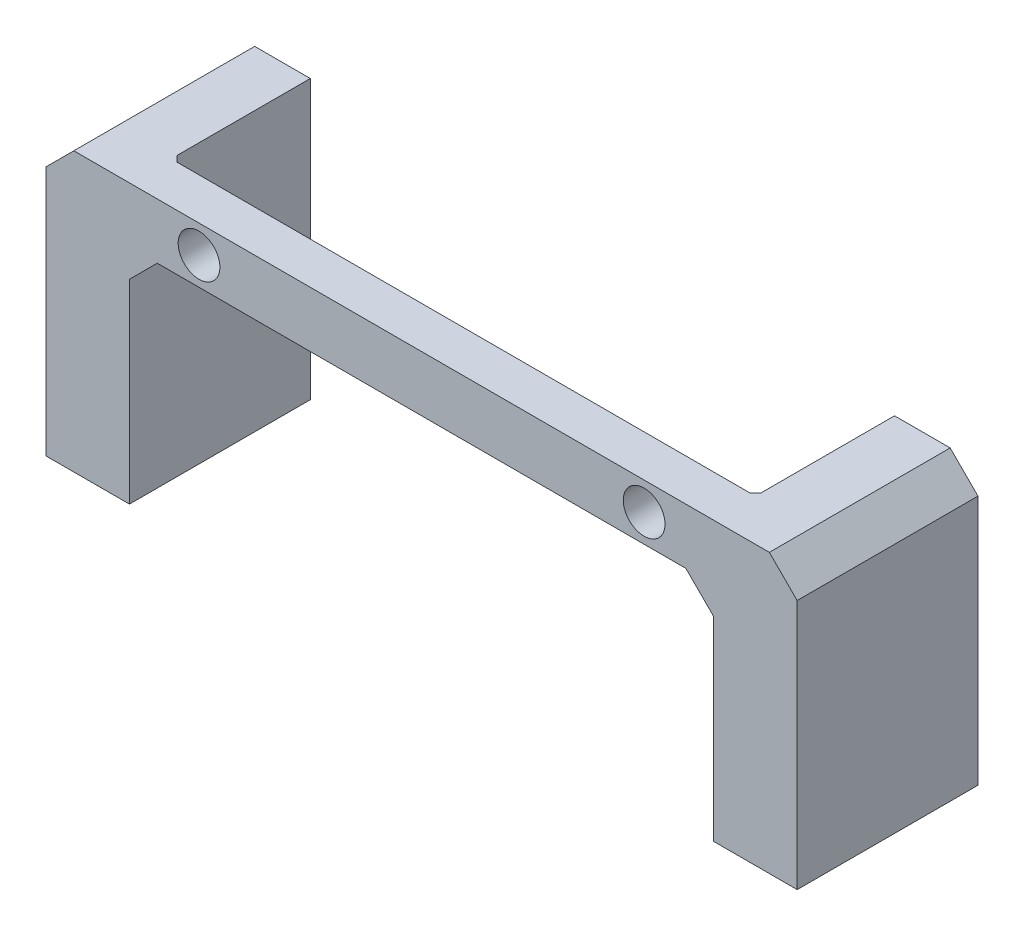
from build123d import *

# Parameters (mm, degrees)
SKETCH_1_W          = 54
SKETCH_1_H          = 20
EXTRUDE_1_DEPTH     = 13
SKETCH_2_W          = 42
SKETCH_2_H          = 16
CUT_EXTRUDE_1_DEPTH = 32.591137998
SKETCH_3_R          = 1.5
CUT_EXTRUDE_2_DEPTH = 32.591137998
SKETCH_4_R          = 1.5
CUT_EXTRUDE_3_DEPTH = 13
SKETCH_5_W          = 42
SKETCH_5_H          = 10
CUT_EXTRUDE_4_DEPTH = 37.027767069
CHAMFER_1_SIZE      = 2
CHAMFER_2_SIZE      = 2
CHAMFER_3_SIZE      = 0.4


with BuildPart() as part:
    # 草圖1 → 填料-伸長1 (new body)
    with BuildSketch(Plane.XY):
        Rectangle(SKETCH_1_W, SKETCH_1_H)
    extrude(amount=EXTRUDE_1_DEPTH)

    # 草圖2 → 除料-伸長1 (cut, through all)
    with BuildSketch(Plane.XY.offset(13)):
        with Locations((0, -2)):
            Rectangle(SKETCH_2_W, SKETCH_2_H)
    extrude(amount=-CUT_EXTRUDE_1_DEPTH, mode=Mode.SUBTRACT)

    # 草圖3 → 除料-伸長2 (cut, through all)
    with BuildSketch(Plane.XY.offset(13)):
        with Locations((-16, 8)):
            Circle(SKETCH_3_R)
        with Locations((16, 8)):
            Circle(SKETCH_3_R)
    extrude(amount=-CUT_EXTRUDE_2_DEPTH, mode=Mode.SUBTRACT)

    # 草圖4 → 除料-伸長3 (cut)
    with BuildSketch(Plane.XZ.offset(10)):
        with Locations(Location((-24, 5, 0), (0, 0, 270))):
            Circle(SKETCH_4_R)
        with Locations(Location((24, 5, 0), (0, 0, 270))):
            Circle(SKETCH_4_R)
    extrude(amount=-CUT_EXTRUDE_3_DEPTH, mode=Mode.SUBTRACT)

    # 草圖5 → 除料-伸長4 (cut, through all)
    with BuildSketch(Plane(origin=(0, 10, 0), x_dir=(1, 0, 0), z_dir=(0, 1, 0))):
        with Locations((0, -5)):
            Rectangle(SKETCH_5_W, SKETCH_5_H)
    extrude(amount=-CUT_EXTRUDE_4_DEPTH, mode=Mode.SUBTRACT)

    # 導角1
    chamfer_1_edges = [part.edges().sort_by_distance(p)[0] for p in [
        (-27, 10, 6.5),
        (27, 10, 6.5),
    ]]
    chamfer(chamfer_1_edges, length=CHAMFER_1_SIZE)

    # 導角2
    chamfer_2_edges = [part.edges().sort_by_distance(p)[0] for p in [
        (21, 6, 11.5),
        (-21, 6, 11.5),
    ]]
    chamfer(chamfer_2_edges, length=CHAMFER_2_SIZE)

    # 導角3
    chamfer_3_edges = [part.edges().sort_by_distance(p)[0] for p in [
        (-21, 7, 10),
        (21, 7, 10),
    ]]
    chamfer(chamfer_3_edges, length=CHAMFER_3_SIZE)


solid = part.part
